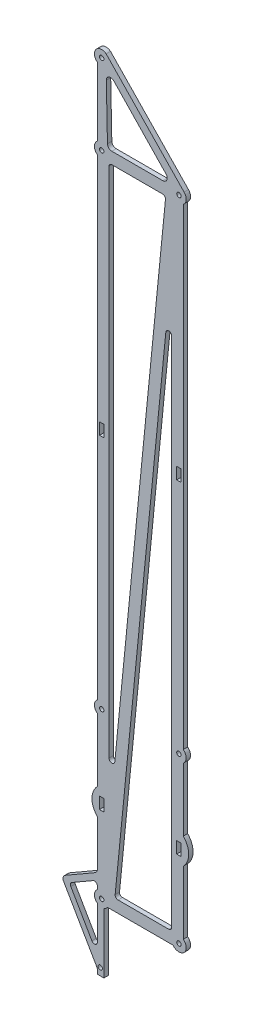
from build123d import *

# Parameters (mm, degrees)
SKETCH_1_R      = 1.5
SKETCH_1_W      = 3.04
SKETCH_1_H      = 8.04
EXTRUDE_1_DEPTH = 3


with BuildPart() as part:
    # 草图1 → 凸台-拉伸1 (new body)
    with BuildSketch(Plane.XY):
        with BuildLine():
            Line((-3, -4), (-3, -328.18))
            ThreePointArc((-3, -328.18), (-5, -332.18), (-3, -336.18))
            Line((-3, -336.18), (-3, -379.66982063))
            ThreePointArc((-3, -379.66982063), (-6.694859274, -388.59), (-3, -397.51017937))
            Line((-3, -397.51017937), (-3, -429.017949192))
            ThreePointArc((-3, -429.017949192), (-3.401923789, -430.517949192), (-4.5, -431.616025404))
            Line((-4.5, -431.616025404), (-25.083647797, -443.5))
            ThreePointArc((-25.083647797, -443.5), (-26.481425275, -445.321619076), (-26.181724008, -447.598076211))
            Line((-26.181724008, -447.598076211), (-20.646282865, -457.185741513))
            Line((-20.646282865, -457.185741513), (-3.401923789, -487.053847577))
            ThreePointArc((-3.401923789, -487.053847577), (-3.102222521, -487.777390442), (-3, -488.553847577))
            Line((-3, -488.553847577), (-3, -491.25))
            Line((-3, -491.25), (1.5, -491.25))
            Line((1.5, -491.25), (1.5, -487.35037357))
            Line((1.5, -487.35037357), (1.5, -485.14962643))
            Line((1.5, -485.14962643), (1.5, -449.769696007))
            ThreePointArc((1.5, -449.769696007), (2.888850289, -449.080997918), (4, -448))
            Line((4, -448), (49, -448))
            ThreePointArc((49, -448), (56.535533906, -448.535533906), (56, -441))
            Line((56, -441), (56, -397.51017937))
            ThreePointArc((56, -397.51017937), (59.694859274, -388.59), (56, -379.66982063))
            Line((56, -379.66982063), (56, -336.18))
            ThreePointArc((56, -336.18), (58, -332.18), (56, -328.18))
            Line((56, -328.18), (56, -4))
            ThreePointArc((56, -4), (57.987421044, -0.3544451), (56.535533906, 3.535533906))
            Line((56.535533906, 3.535533906), (3, 59))
            ThreePointArc((3, 59), (-4, 58), (-3, 51))
            Line((-3, 51), (-3, 4))
            ThreePointArc((-3, 4), (-5, 0), (-3, -4))
        make_face()
        Circle(SKETCH_1_R, mode=Mode.SUBTRACT)
        with Locations((0, -445)):
            Circle(SKETCH_1_R, mode=Mode.SUBTRACT)
        with Locations((0, -332.18)):
            Circle(SKETCH_1_R, mode=Mode.SUBTRACT)
        with Locations(Location((53, -332.18, 0), (0, 0, 180))):
            Circle(SKETCH_1_R, mode=Mode.SUBTRACT)
        with Locations(Location((53, -445, 0), (0, 0, 180))):
            Circle(SKETCH_1_R, mode=Mode.SUBTRACT)
        with Locations(Location((53, 0, 0), (0, 0, 180))):
            Circle(SKETCH_1_R, mode=Mode.SUBTRACT)
        with Locations((0, 55)):
            Circle(SKETCH_1_R, mode=Mode.SUBTRACT)
        with Locations((-1, -486.25)):
            Circle(SKETCH_1_R, mode=Mode.SUBTRACT)
        with BuildLine():
            Line((6.938150971, 3), (41.969807465, 3))
            ThreePointArc((41.969807465, 3), (44.729078046, 4.822534134), (44.135772081, 8.07571609))
            Line((44.135772081, 8.07571609), (8.325634331, 45.44281635))
            ThreePointArc((8.325634331, 45.44281635), (5.012233456, 46.138993121), (3.160320545, 43.30461382))
            Line((3.160320545, 43.30461382), (3.938801801, 5.937513559))
            ThreePointArc((3.938801801, 5.937513559), (4.839039174, 3.85670122), (6.938150971, 3))
        make_face(mode=Mode.SUBTRACT)
        with BuildLine():
            Line((48, -86.226063366), (48, -438))
            ThreePointArc((48, -438), (47.414213562, -439.414213562), (46, -440))
            Line((46, -440), (11.226944195, -440))
            ThreePointArc((11.226944195, -440), (9.744803089, -439.342854326), (9.236644598, -437.803257741))
            Line((9.236644598, -437.803257741), (44.009700404, -86.029321107))
            ThreePointArc((44.009700404, -86.029321107), (46.098490627, -84.228489939), (48, -86.226063366))
        make_face(mode=Mode.SUBTRACT)
        with BuildLine():
            Line((43.763355402, -7.196742259), (8.990299596, -358.970678893))
            ThreePointArc((8.990299596, -358.970678893), (6.901509373, -360.771510061), (5, -358.773936634))
            Line((5, -358.773936634), (5, -7))
            ThreePointArc((5, -7), (5.585786438, -5.585786438), (7, -5))
            Line((7, -5), (41.773055805, -5))
            ThreePointArc((41.773055805, -5), (43.255196911, -5.657145674), (43.763355402, -7.196742259))
        make_face(mode=Mode.SUBTRACT)
        with BuildLine():
            Line((-17.18218125, -455.185741513), (-21.217622393, -448.196152423))
            ThreePointArc((-21.217622393, -448.196152423), (-21.417423238, -446.678514333), (-20.485571585, -445.464101615))
            Line((-20.485571585, -445.464101615), (-6, -437.100852961))
            ThreePointArc((-6, -437.100852961), (-4, -437.100852961), (-3, -438.832903769))
            Line((-3, -438.832903769), (-3, -441))
            ThreePointArc((-3, -441), (-5, -445), (-3, -449))
            Line((-3, -449), (-3, -472.285898385))
            ThreePointArc((-3, -472.285898385), (-4.48236191, -474.217750037), (-6.732050808, -473.285898385))
            Line((-6.732050808, -473.285898385), (-17.18218125, -455.185741513))
        make_face(mode=Mode.SUBTRACT)
        Polygon((-1.52, -388.59), (-1.52, -384.57), (1.52, -384.57), (1.52, -392.61), (-1.52, -392.61), align=None, mode=Mode.SUBTRACT)
        Polygon((54.52, -392.61), (54.52, -388.59), (54.52, -384.57), (51.48, -384.57), (51.48, -392.61), align=None, mode=Mode.SUBTRACT)
        with Locations((53, -166.09)):
            Rectangle(SKETCH_1_W, SKETCH_1_H, mode=Mode.SUBTRACT)
        with Locations((0, -166.09)):
            Rectangle(SKETCH_1_W, SKETCH_1_H, mode=Mode.SUBTRACT)
    extrude(amount=EXTRUDE_1_DEPTH)


solid = part.part
